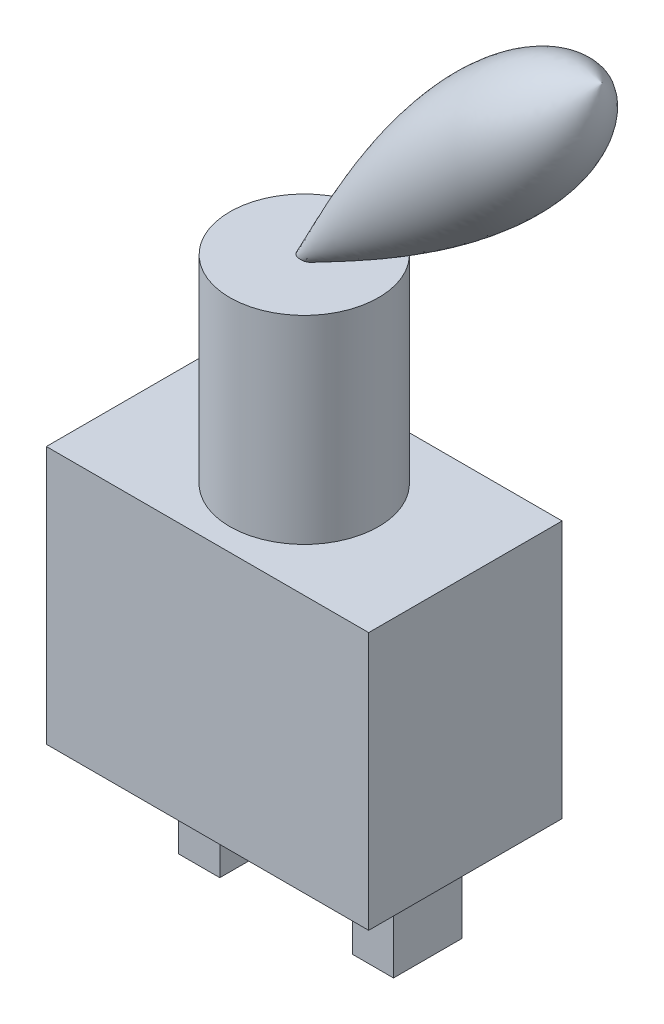
from build123d import *

# Parameters (mm, degrees)
SKETCH3_W           = 13
SKETCH3_H           = 10.4
BOSS_EXTRUDE1_DEPTH = 3.9
SKETCH4_R           = 3
BOSS_EXTRUDE2_DEPTH = 8
SKETCH6_W           = 1.669818936
SKETCH6_H           = 2.764411597
SKETCH6_W_2         = 1.648906897
BOSS_EXTRUDE3_DEPTH = 4


with BuildPart() as part:
    # Sketch3 → Boss-Extrude1 (new, symmetric)
    with BuildSketch(Plane.XY):
        Rectangle(SKETCH3_W, SKETCH3_H)
    extrude(amount=BOSS_EXTRUDE1_DEPTH, both=True)

    # Sketch4 → Boss-Extrude2 (add)
    with BuildSketch(Plane(origin=(0, 5.2, 0), x_dir=(1, 0, 0), z_dir=(0, 1, 0))):
        with Locations(Location((0, 0, 0), (0, 0, 270))):
            Circle(SKETCH4_R)
    extrude(amount=BOSS_EXTRUDE2_DEPTH)

    # Sketch5 → Revolve1 (revolve)
    with BuildSketch(Plane(origin=(-6.6, 6.6, 0), x_dir=(-0.7071067811865477, -0.7071067811865475, 0), z_dir=(0.7071067811865475, -0.7071067811865477, 0))):
        with BuildLine():
            Line((-26.301723622, 0), (-8.28734559, 0))
            add(Edge.make_bspline(
                [(-8.28734559, 0), (-9.692681087, -0.059325573), (-22.80470737, -5.257488567), (-26.301723622, 0)],
                knots=[0, 0, 0, 0, 1, 1, 1, 1], degree=3))
        make_face()
    revolve(axis=Axis((0, 13.2, 0), (0.7071067811865477, 0.7071067811865474, 0)))

    # Sketch6 → Boss-Extrude3 (add)
    with BuildSketch(Plane.XZ.offset(5.2)):
        with Locations((-3.174764559, -0.318229702)):
            Rectangle(SKETCH6_W, SKETCH6_H)
        with Locations((3.840702157, -0.318229702)):
            Rectangle(SKETCH6_W_2, SKETCH6_H)
    extrude(amount=BOSS_EXTRUDE3_DEPTH)


solid = part.part
